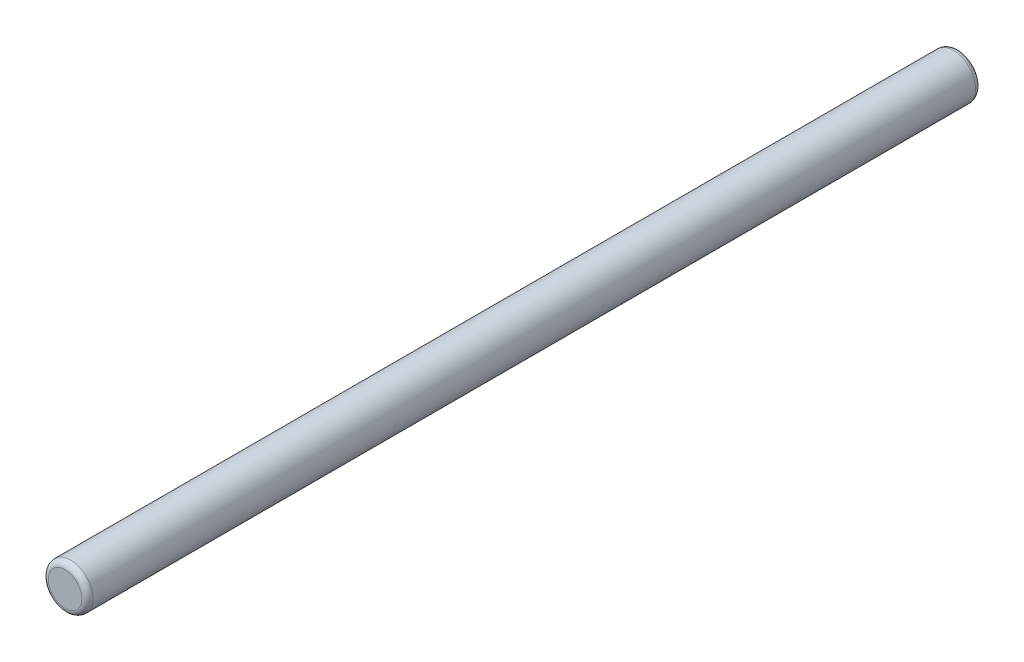
from build123d import *

# Parameters (mm, degrees)
ESBO_O1_R                = 1.2
RESSALTO_EXTRUS_O1_DEPTH = 48
FILETE1_R                = 0.3


with BuildPart() as part:
    # Esboço1 → Ressalto-extrusão1 (new body)
    with BuildSketch(Plane.XY):
        Circle(ESBO_O1_R)
    extrude(amount=RESSALTO_EXTRUS_O1_DEPTH)

    # Filete1
    filete1_edges = [part.edges().sort_by_distance(p)[0] for p in [
        (-1.2, 0, 0),
        (-1.2, 0, 48),
    ]]
    fillet(filete1_edges, radius=FILETE1_R)


solid = part.part
